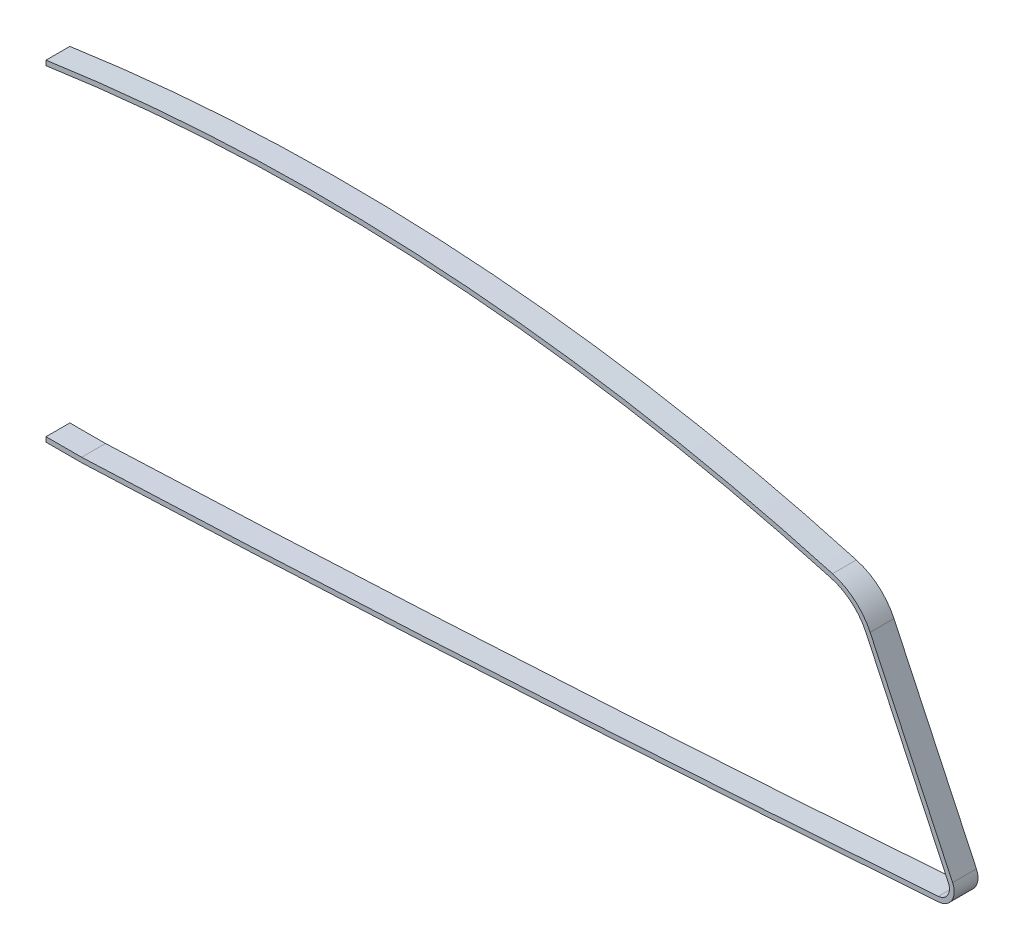
from build123d import *

# Parameters (mm, degrees)
BOSS_EXTRUDE1_DEPTH = 10
SKETCH3_W           = 208.746083537
SKETCH3_H           = 274.535725978
CUT_EXTRUDE1_DEPTH  = 399.651564654


with BuildPart() as part:
    # Sketch2 → Boss-Extrude1 (new body)
    with BuildSketch(Plane.XY.offset(-4)):
        with BuildLine():
            Line((-300, 17.25), (-9.906933746, 17.25))
            ThreePointArc((-9.906933746, 17.25), (-7.67705834, 17.349645471), (-5.464958693, 17.647787546))
            ThreePointArc((-5.464958693, 17.647787546), (173.262167791, 29.246699007), (349.996014284, 0.211065854))
            ThreePointArc((349.996014284, 0.211065854), (359.352395656, -4.784442191), (365.795573071, -13.209549776))
            Line((365.795573071, -13.209549776), (400.384507401, -86.847766013))
            ThreePointArc((400.384507401, -86.847766013), (400.778842945, -87.899120346), (401, -89))
            ThreePointArc((401, -89), (399.447287587, -94.279668904), (394.557793346, -96.805270939))
            ThreePointArc((394.557793346, -96.805270939), (214.863177419, -108.403215094), (35, -117))
            Line((35, -117), (-30.25, -117))
            Line((-30.25, -117), (-293.242078622, -117))
            ThreePointArc((-293.242078622, -117), (-293.197036902, -109.999972274), (-293.25, -103))
            ThreePointArc((-293.25, -103), (-297.900702689, -41.860509444), (-310, 18.25))
            ThreePointArc((-310, 18.25), (-305.024937811, 17.500621894), (-300, 17.25))
        make_face()
        with BuildLine():
            Line((-300, 15.25), (-9.906933746, 15.25))
            ThreePointArc((-9.906933746, 15.25), (-7.498668308, 15.357617109), (-5.109600689, 15.67961055))
            ThreePointArc((-5.109600689, 15.67961055), (173.164177958, 27.249100951), (349.449732641, -1.712882265))
            ThreePointArc((349.449732641, -1.712882265), (358.057603503, -6.308749667), (363.985326724, -14.059848645))
            Line((363.985326724, -14.059848645), (398.574261055, -87.698064882))
            ThreePointArc((398.574261055, -87.698064882), (398.855929301, -88.449032263), (399.013898626, -89.235374873))
            ThreePointArc((399.013898626, -89.235374873), (397.904818331, -93.006566947), (394.412322444, -94.8105684))
            ThreePointArc((394.412322444, -94.8105684), (214.770700526, -106.405257008), (34.960579781, -115))
            Line((34.960579781, -115), (-30.25, -115))
            Line((-30.25, -115), (-291.219119939, -115))
            ThreePointArc((-291.219119939, -115), (-291.198633765, -108.985341109), (-291.250212173, -102.970868486))
            ThreePointArc((-291.250212173, -102.970868486), (-295.709152828, -43.127202467), (-307.277212671, 15.756806448))
            ThreePointArc((-307.277212671, 15.756806448), (-303.647419534, 15.376854871), (-300, 15.25))
        make_face(mode=Mode.SUBTRACT)
    extrude(amount=BOSS_EXTRUDE1_DEPTH)

    # Sketch3 → Cut-Extrude1 (cut, through all)
    with BuildSketch(Plane(origin=(20, 0, 0), x_dir=(0, 0, -1), z_dir=(1, 0, 0))):
        with Locations((3.946589657, -49.091759287)):
            Rectangle(SKETCH3_W, SKETCH3_H)
    extrude(amount=-CUT_EXTRUDE1_DEPTH, mode=Mode.SUBTRACT)


solid = part.part
